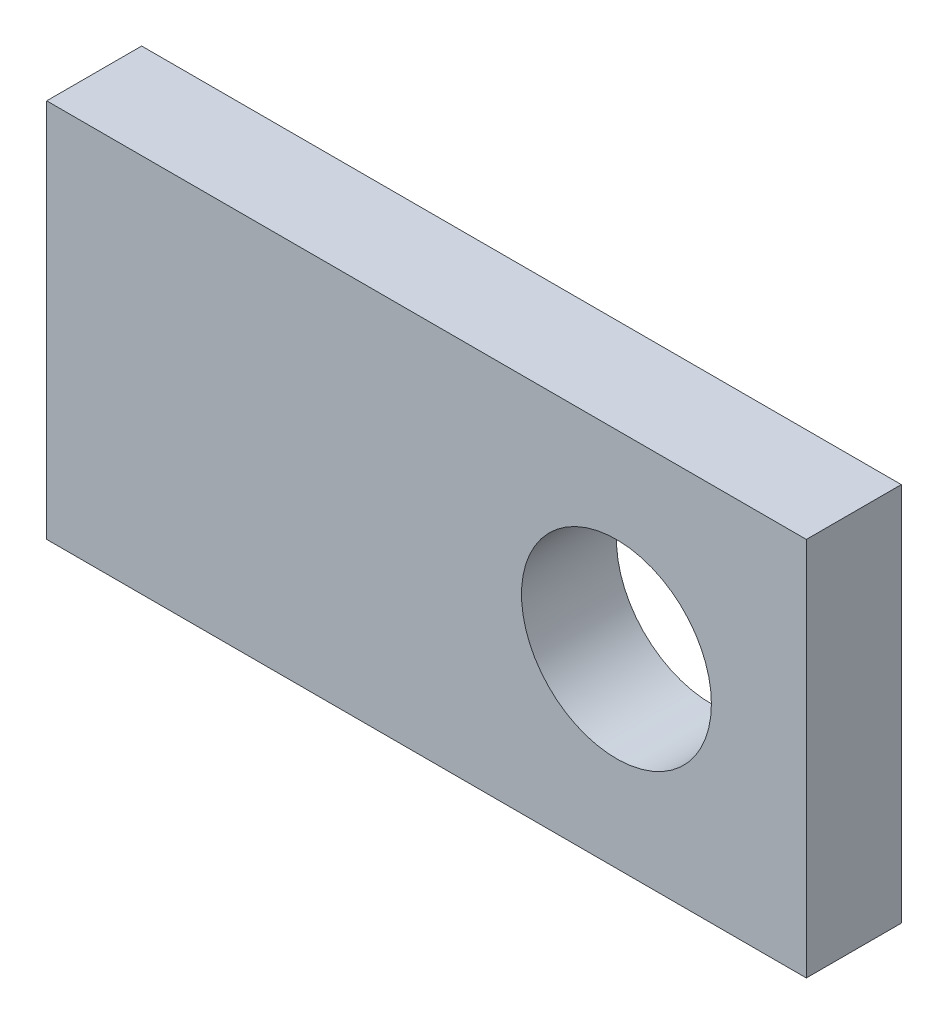
from build123d import *

# Parameters (mm, degrees)
CROQUIS1_W              = 50.8
CROQUIS1_H              = 25.4
CROQUIS1_R              = 6.35
SALIENTE_EXTRUIR1_DEPTH = 6.35


with BuildPart() as part:
    # Croquis1 → Saliente-Extruir1 (new body)
    with BuildSketch(Plane.XY):
        with Locations((25.4, 12.7)):
            Rectangle(CROQUIS1_W, CROQUIS1_H)
        with Locations((38.1, 12.7)):
            Circle(CROQUIS1_R, mode=Mode.SUBTRACT)
    extrude(amount=SALIENTE_EXTRUIR1_DEPTH)


solid = part.part
